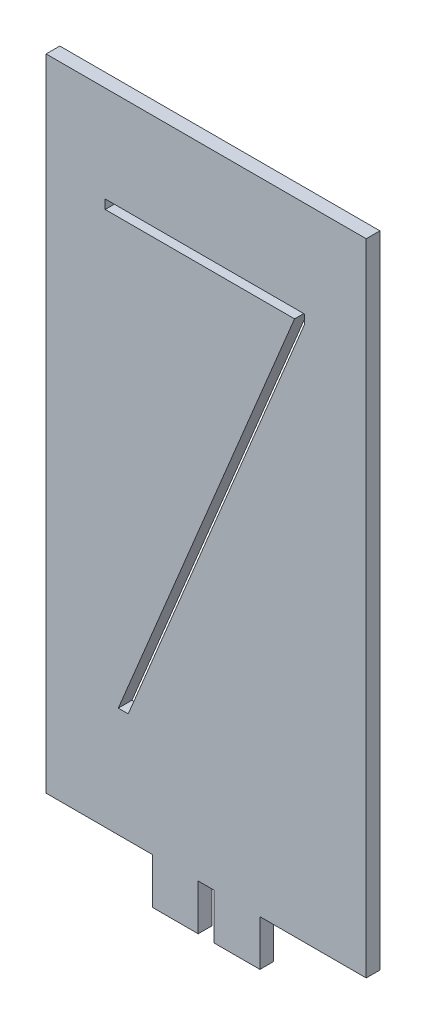
from build123d import *

# Parameters (mm, degrees)
SKIZZE1_W                       = 35
SKIZZE1_H                       = 75
AUFSATZ_LINEAR_AUSTRAGEN1_DEPTH = 1.5
SKIZZE2_W                       = 11.63
SKIZZE2_H                       = 5
SKIZZE2_W_2                     = 11.62
SKIZZE2_W_3                     = 1.75
SCHNITT_LINEAR_AUSTRAGEN1_DEPTH = 1.5
SCHNITT_LINEAR_AUSTRAGEN7_DEPTH = 20


with BuildPart() as part:
    # Skizze1 → Aufsatz-Linear austragen1 (new body)
    with BuildSketch(Plane.XY):
        with Locations((17.5, 37.5)):
            Rectangle(SKIZZE1_W, SKIZZE1_H)
    extrude(amount=AUFSATZ_LINEAR_AUSTRAGEN1_DEPTH)

    # Skizze2 → Schnitt-Linear austragen1 (cut)
    with BuildSketch(Plane.XY.offset(1.5)):
        with Locations((5.815, 2.5)):
            Rectangle(SKIZZE2_W, SKIZZE2_H)
        with Locations((29.19, 2.5)):
            Rectangle(SKIZZE2_W_2, SKIZZE2_H)
        with Locations((17.505, 2.5)):
            Rectangle(SKIZZE2_W_3, SKIZZE2_H)
    extrude(amount=-SCHNITT_LINEAR_AUSTRAGEN1_DEPTH, mode=Mode.SUBTRACT)

    # Skizze12 → Schnitt-Linear austragen7 (cut)
    with BuildSketch(Plane.XY.offset(1.5)):
        Polygon((6.459240655, 64.5), (28.25, 64.5), (28.25, 63.5), (8.976723544, 17), (7.894229713, 17), (27.167506169, 63.5), (6.459240655, 63.5), align=None)
    extrude(amount=-SCHNITT_LINEAR_AUSTRAGEN7_DEPTH, mode=Mode.SUBTRACT)


solid = part.part
